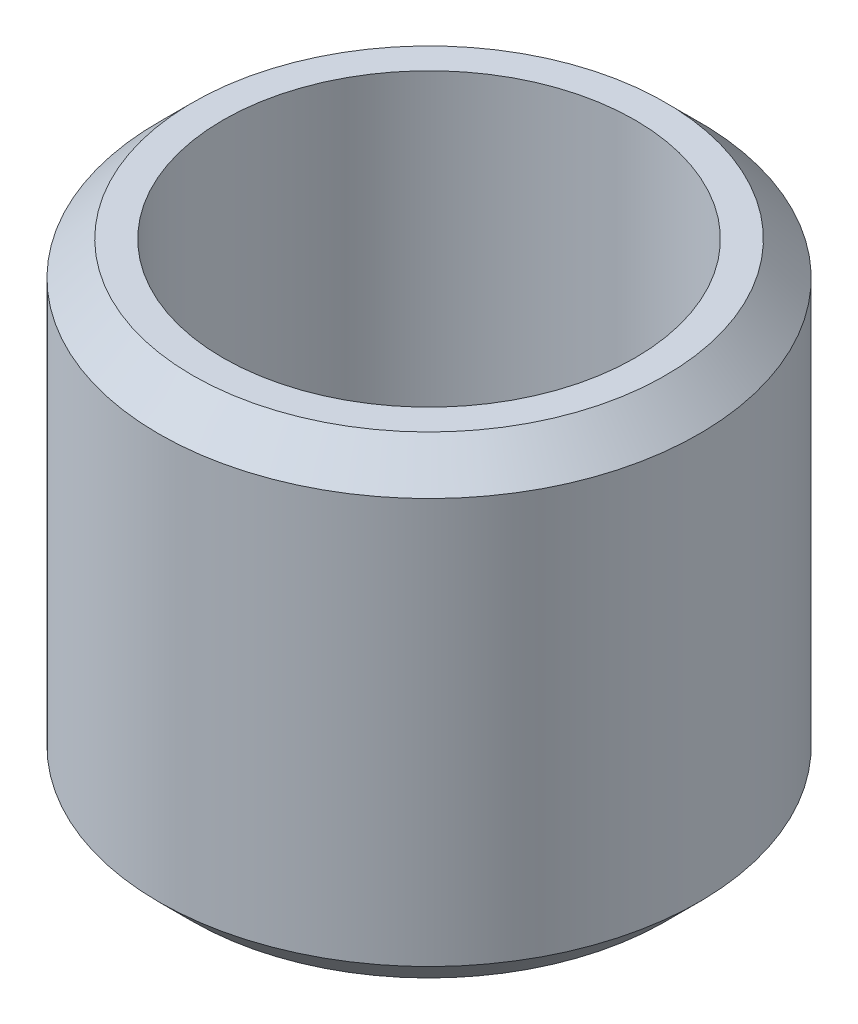
from build123d import *

# Parameters (mm, degrees)
SKETCH1_R           = 4
BOSS_EXTRUDE1_DEPTH = 7
SKETCH2_R           = 3.05
CUT_EXTRUDE1_DEPTH  = 6
CHAMFER1_SIZE       = 0.5


with BuildPart() as part:
    # Sketch1 → Boss-Extrude1 (new body)
    with BuildSketch(Plane(origin=(0, 0, 0), x_dir=(1, 0, 0), z_dir=(0, 1, 0))):
        with Locations(Location((0, 0, 0), (0, 0, 270))):
            Circle(SKETCH1_R)
    extrude(amount=BOSS_EXTRUDE1_DEPTH)

    # Sketch2 → Cut-Extrude1 (cut)
    with BuildSketch(Plane(origin=(0, 7, 0), x_dir=(1, 0, 0), z_dir=(0, 1, 0))):
        with Locations(Location((0, 0, 0), (0, 0, 270))):
            Circle(SKETCH2_R)
    extrude(amount=-CUT_EXTRUDE1_DEPTH, mode=Mode.SUBTRACT)

    # Chamfer1
    chamfer1_edges = [part.edges().sort_by_distance(p)[0] for p in [
        (0, 0, -4),
        (0, 7, -4),
    ]]
    chamfer(chamfer1_edges, length=CHAMFER1_SIZE)


solid = part.part
